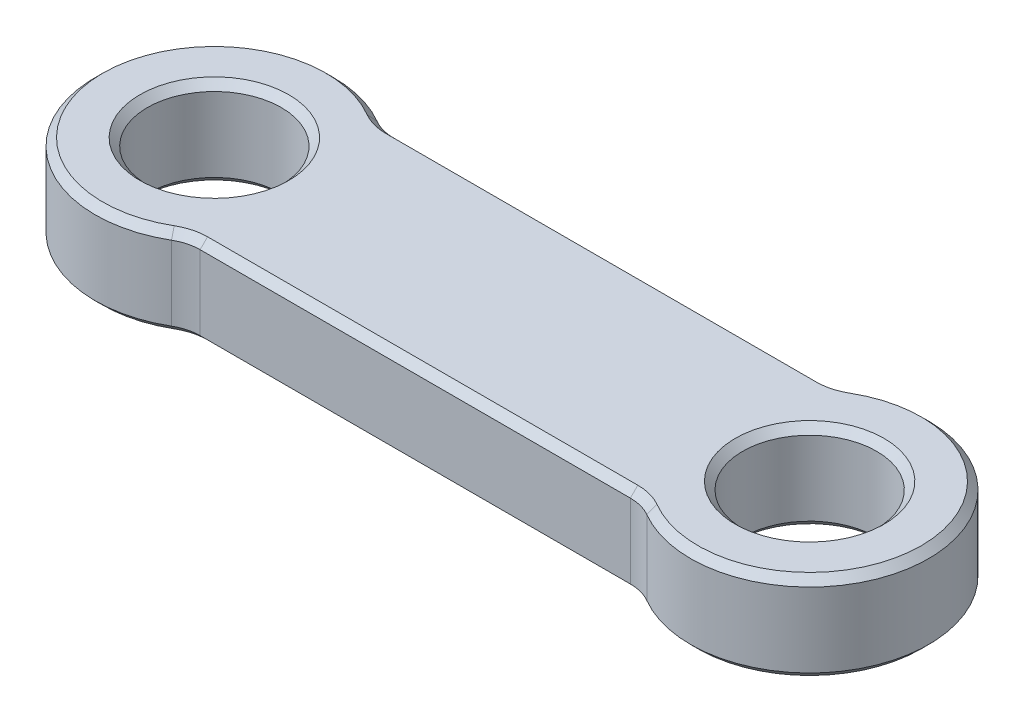
from build123d import *

# Parameters (mm, degrees)
SKETCH_1_R      = 4.5
EXTRUDE_1_DEPTH = 6
FILLET_1_R      = 3
CHAMFER_1_SIZE  = 0.5


with BuildPart() as part:
    # 草图1 → 凸台-拉伸1 (new body)
    with BuildSketch(Plane(origin=(0, 0, 0), x_dir=(1, 0, 0), z_dir=(0, 1, 0))):
        with BuildLine():
            Line((-15.336310473, 6.5), (15.336310473, 6.5))
            ThreePointArc((15.336310473, 6.5), (28, 0), (15.336310473, -6.5))
            Line((15.336310473, -6.5), (-15.336310473, -6.5))
            ThreePointArc((-15.336310473, -6.5), (-28, 0), (-15.336310473, 6.5))
        make_face()
        with Locations(Location((-20, 0, 0), (0, 0, 270))):
            Circle(SKETCH_1_R, mode=Mode.SUBTRACT)
        with Locations(Location((20, 0, 0), (0, 0, 270))):
            Circle(SKETCH_1_R, mode=Mode.SUBTRACT)
    extrude(amount=EXTRUDE_1_DEPTH)

    # 圆角1
    fillet_1_edges = [part.edges().sort_by_distance(p)[0] for p in [
        (-15.336310473, 3, -6.5),
        (15.336310473, 3, -6.5),
        (15.336310473, 3, 6.5),
        (-15.336310473, 3, 6.5),
    ]]
    fillet(fillet_1_edges, radius=FILLET_1_R)

    # 倒角1
    chamfer_1_edges = [part.edges().sort_by_distance(p)[0] for p in [
        (-20, 0, -4.5),
        (-20, 6, -4.5),
        (20, 0, -4.5),
        (20, 6, -4.5),
        (-28, 0, 0),
        (-28, 6, 0),
        (0, 0, -6.5),
        (0, 6, -6.5),
        (28, 0, 0),
        (28, 6, 0),
        (0, 0, 6.5),
        (0, 6, 6.5),
        (-15.238081199, 0, -6.604078103),
        (-15.238081199, 6, -6.604078103),
        (15.238081199, 0, -6.604078103),
        (15.238081199, 6, -6.604078103),
        (15.238081199, 0, 6.604078103),
        (15.238081199, 6, 6.604078103),
        (-15.238081199, 0, 6.604078103),
        (-15.238081199, 6, 6.604078103),
    ]]
    chamfer(chamfer_1_edges, length=CHAMFER_1_SIZE)


solid = part.part
